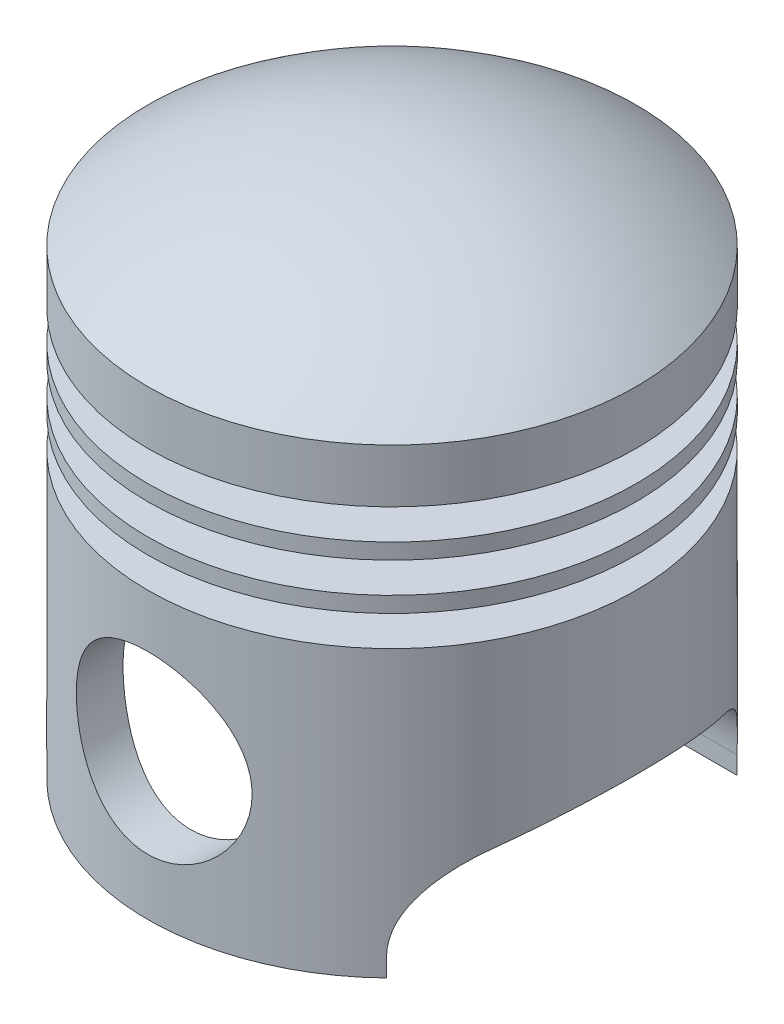
from build123d import *

# Parameters (mm, degrees)
SKETCH1_R               = 26.45
BOSS_EXTRUDE1_DEPTH     = 50
CUT_EXTRUDE2_START      = -5.8
SKETCH2_OUTSIDE_W       = 72.896
SKETCH2_OUTSIDE_H       = 72.896
SKETCH2_OUTSIDE_R       = 21
CUT_EXTRUDE2_DEPTH      = 3.3
LPATTERN1_COUNT         = 3
LPATTERN1_PITCH         = 5
SKETCH5_R               = 21.804512809
CUT_EXTRUDE4_DEPTH      = 28
DOME1_FACE_RADIUS       = 26.45
DOME1_HEIGHT            = 9
CUT_EXTRUDE5_DEPTH      = 70.858464054
CUT_EXTRUDE5_DEPTH_BACK = 70.858464054
SKETCH6_R               = 9.520481224
CUT_EXTRUDE6_DEPTH      = 70.85846413
CUT_EXTRUDE6_DEPTH_BACK = 70.85846413
FILLET1_R               = 10
FILLET2_R               = 10


with BuildPart() as part:
    # Sketch1 → Boss-Extrude1 (new body)
    with BuildSketch(Plane(origin=(0, 0, 0), x_dir=(1, 0, 0), z_dir=(0, 1, 0))):
        with Locations(Location((0, 0, 0), (0, 0, 270))):
            Circle(SKETCH1_R)
    extrude(amount=BOSS_EXTRUDE1_DEPTH)

    # Sketch2 outside → Cut-Extrude2 (cut)
    with BuildSketch(Plane(origin=(0, 50, 0), x_dir=(1, 0, 0), z_dir=(0, 1, 0)).offset(CUT_EXTRUDE2_START)):
        Rectangle(SKETCH2_OUTSIDE_W, SKETCH2_OUTSIDE_H)
        with Locations(Location((0, 0, 0), (0, 0, 270))):
            Circle(SKETCH2_OUTSIDE_R, mode=Mode.SUBTRACT)
    cut_extrude2 = extrude(amount=-CUT_EXTRUDE2_DEPTH, mode=Mode.SUBTRACT)

    # LPattern1: Cut-Extrude2 ×3
    with Locations(*[(0, -i * LPATTERN1_PITCH, 0) for i in range(1, LPATTERN1_COUNT)]):
        add(cut_extrude2, mode=Mode.SUBTRACT)

    # Sketch5 → Cut-Extrude4 (cut)
    with BuildSketch(Plane.XZ):
        with Locations(Location((0, 0, 0), (0, 0, 270))):
            Circle(SKETCH5_R)
    extrude(amount=-CUT_EXTRUDE4_DEPTH, mode=Mode.SUBTRACT)

    # Dome1: a dome of height H over a round flat face of radius A is a cap of a sphere of radius (A * A + H * H) / (2 * H)
    dome1_r = (DOME1_FACE_RADIUS * DOME1_FACE_RADIUS + DOME1_HEIGHT * DOME1_HEIGHT) / (2 * DOME1_HEIGHT)
    dome1_base = Plane((0, 50, 0), z_dir=(0, 1, 0))
    with Locations(dome1_base.offset(DOME1_HEIGHT - dome1_r)):
        dome1_ball = Sphere(dome1_r, mode=Mode.PRIVATE)
    add(split(dome1_ball, bisect_by=dome1_base, keep=Keep.TOP, mode=Mode.PRIVATE))

    # Sketch6 → Cut-Extrude5 (cut, two sides: drawn at the far end of the back side and taken through both)
    with BuildSketch(Plane.XY.offset(-CUT_EXTRUDE5_DEPTH_BACK)):
        with Locations((0, 15.633194444)):
            Circle(SKETCH6_R)
    extrude(amount=CUT_EXTRUDE5_DEPTH + CUT_EXTRUDE5_DEPTH_BACK, mode=Mode.SUBTRACT)

    # Sketch8 → Cut-Extrude6 (cut, two sides: drawn at the far end of the back side and taken through both)
    with BuildSketch(Plane(origin=(0, 0, 0), x_dir=(0, 0, -1), z_dir=(1, 0, 0)).offset(-CUT_EXTRUDE6_DEPTH_BACK)):
        with BuildLine():
            Line((-19, 0), (-19, 8))
            ThreePointArc((-19, 8), (0, 13.606123087), (19, 8))
            Line((19, 8), (19, 0))
            Line((19, 0), (-19, 0))
        make_face()
    extrude(amount=CUT_EXTRUDE6_DEPTH + CUT_EXTRUDE6_DEPTH_BACK, mode=Mode.SUBTRACT)

    # Fillet1
    fillet1_edges = [part.edges().sort_by_distance(p)[0] for p in [
        (14.549333798, 8, -19),
        (14.549333798, 8, 19),
    ]]
    fillet(fillet1_edges, radius=FILLET1_R)

    # Fillet2
    fillet2_edges = [part.edges().sort_by_distance(p)[0] for p in [
        (-14.549333798, 8, 19),
        (-14.549333798, 8, -19),
    ]]
    fillet(fillet2_edges, radius=FILLET2_R)


solid = part.part
